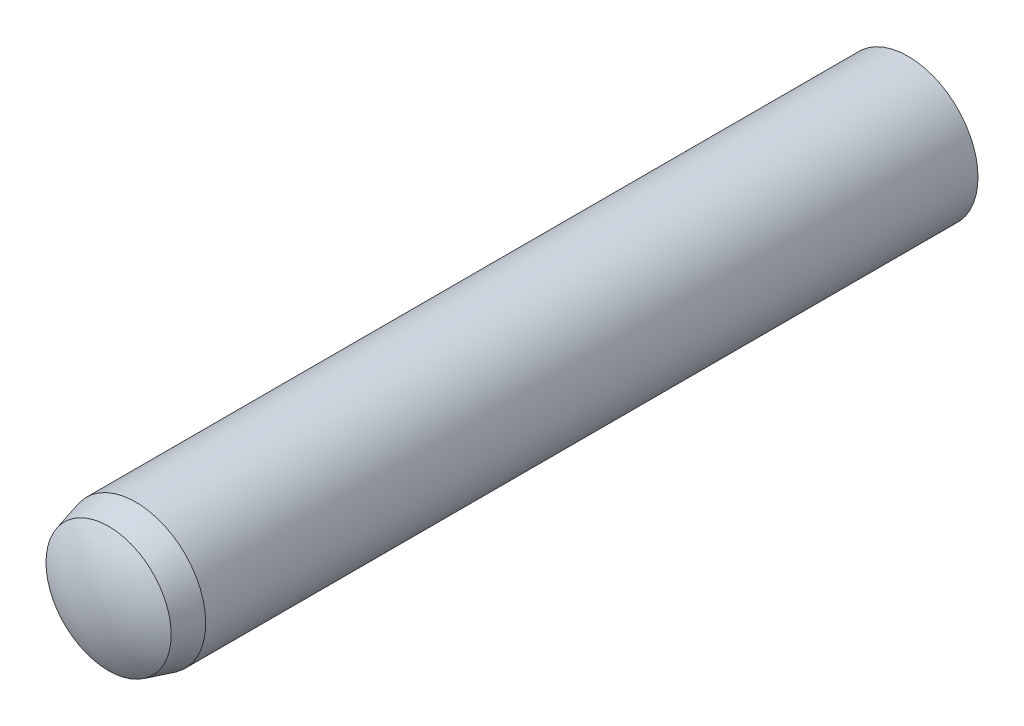
from build123d import *


with BuildPart() as part:
    # Sketch3 → Revolve1 (revolve)
    with BuildSketch(Plane(origin=(0, 0, 0), x_dir=(0, 0, -1), z_dir=(1, 0, 0))):
        with BuildLine():
            Line((-9, 0), (9, 0))
            ThreePointArc((9, 0), (8.885076627, 0.783022988), (8.55, 1.5))
            Line((8.55, 1.5), (-8.025, 1.5))
            Line((-8.025, 1.5), (-8.61, 1.343249722))
            ThreePointArc((-8.61, 1.343249722), (-8.90052754, 0.699360389), (-9, 0))
        make_face()
    revolve(axis=Axis((0, 0, 9), (0, 0, -1)))


solid = part.part
